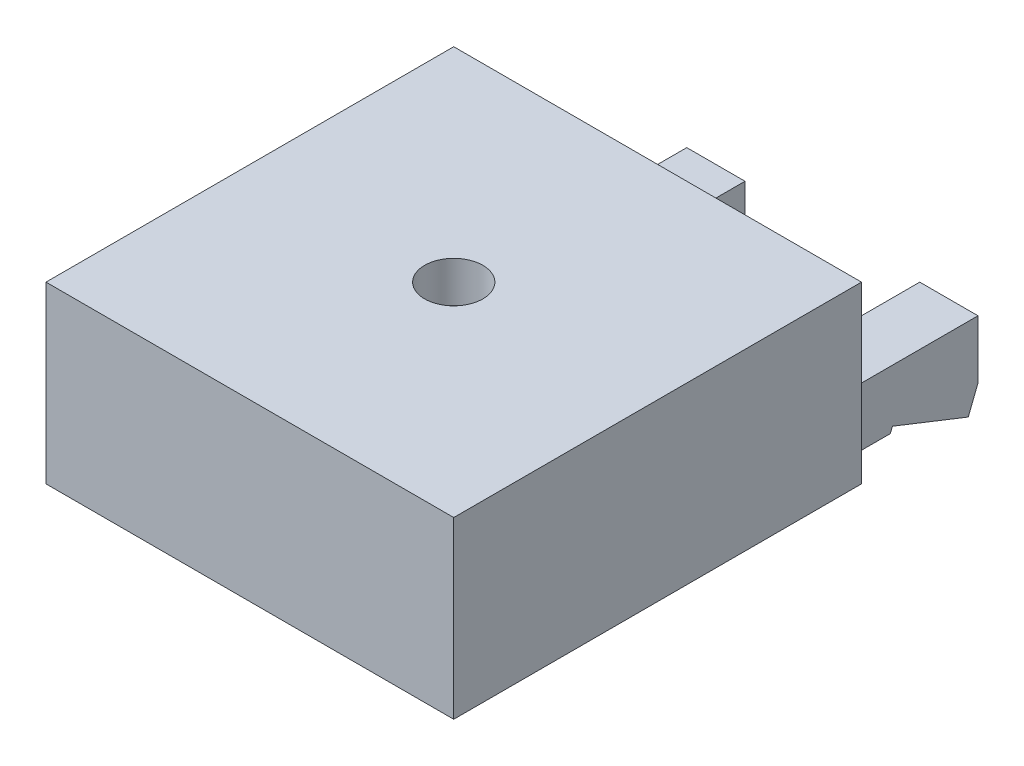
from build123d import *

# Parameters (mm, degrees)
ESQUISSE1_W              = 70
ESQUISSE1_H              = 70
BOSS_EXTRU_4_DEPTH       = 30
ESQUISSE5_W              = 60
ESQUISSE5_H              = 60
ENL_V_MAT_EXTRU_3_DEPTH  = 23
ESQUISSE6_R              = 5
ENL_V_MAT_EXTRU_4_DEPTH  = 23
ESQUISSE28_W             = 10
ESQUISSE28_H             = 30
BOSS_EXTRU_8_DEPTH       = 5
BOSS_EXTRU_9_DEPTH       = 10
ESQUISSE30_W             = 10
ESQUISSE30_H             = 30
BOSS_EXTRU_10_DEPTH      = 5
BOSS_EXTRU_14_DEPTH      = 10
ENL_V_MAT_EXTRU_6_DEPTH  = 10
ENL_V_MAT_EXTRU_15_DEPTH = 14


with BuildPart() as part:
    # Esquisse1 → Boss.-Extru.4 (new body)
    with BuildSketch(Plane(origin=(0, 0, 0), x_dir=(1, 0, 0), z_dir=(0, 1, 0))):
        with Locations((35, 35)):
            Rectangle(ESQUISSE1_W, ESQUISSE1_H)
    extrude(amount=BOSS_EXTRU_4_DEPTH)

    # Esquisse5 → Enlèv. mat.-Extru.3 (cut)
    with BuildSketch(Plane(origin=(0, 0, 0), x_dir=(-1, 0, 0), z_dir=(0, -1, 0))):
        with Locations((-35, 35)):
            Rectangle(ESQUISSE5_W, ESQUISSE5_H)
    extrude(amount=-ENL_V_MAT_EXTRU_3_DEPTH, mode=Mode.SUBTRACT)

    # Esquisse6 → Enlèv. mat.-Extru.4 (cut)
    with BuildSketch(Plane(origin=(0, 23, 0), x_dir=(-1, 0, 0), z_dir=(0, -1, 0))):
        with Locations(Location((-35, 35, 0), (0, 0, 90))):
            Circle(ESQUISSE6_R)
    extrude(amount=-ENL_V_MAT_EXTRU_4_DEPTH, mode=Mode.SUBTRACT)

    # Esquisse28 → Boss.-Extru.8 (add, symmetric)
    with BuildSketch(Plane.XZ):
        with Locations((55.004966989, -85)):
            Rectangle(ESQUISSE28_W, ESQUISSE28_H)
    extrude(amount=BOSS_EXTRU_8_DEPTH, both=True)

    # Esquisse29 → Boss.-Extru.9 (add)
    with BuildSketch(Plane(origin=(60.004966989, 0, 0), x_dir=(0, 0, -1), z_dir=(1, 0, 0))):
        Polygon((98.641624501, -8.437704854), (100, -5), (85, -5), (97.962436751, -10.156557281), align=None)
    extrude(amount=-BOSS_EXTRU_9_DEPTH)

    # Esquisse30 → Boss.-Extru.10 (add, symmetric)
    with BuildSketch(Plane.XZ):
        with Locations((15.004966989, -85)):
            Rectangle(ESQUISSE30_W, ESQUISSE30_H)
    extrude(amount=BOSS_EXTRU_10_DEPTH, both=True)

    # Esquisse39 → Boss.-Extru.14 (add)
    with BuildSketch(Plane.ZY.offset(-10.004966989)):
        Polygon((-100, -5), (-95.960946885, -15.231620103), (-85, -5), align=None)
    extrude(amount=-BOSS_EXTRU_14_DEPTH)

    # Esquisse40 → Enlèv. mat.-Extru.6 (cut)
    with BuildSketch(Plane(origin=(0, -34.827896321, -88.22508495), x_dir=(-1, 0, 0), z_dir=(0, -0.3671866467775486, -0.930147282116257))):
        Polygon((-20.004966989, 21.067928267), (-20.004966989, 22.067928267), (-10.004966989, 21.067928267), align=None)
    extrude(amount=-ENL_V_MAT_EXTRU_6_DEPTH, mode=Mode.SUBTRACT)

    # Esquisse41 → Enlèv. mat.-Extru.15 (cut)
    with BuildSketch(Plane(origin=(0, -34.85291455, -88.203912367), x_dir=(-1, 0, 0), z_dir=(0, -0.36749110102927884, -0.9300270375985252))):
        Polygon((-60.004966989, 27.554450861), (-60.004966989, 26.554450861), (-50.004966989, 26.554450861), align=None)
    extrude(amount=-ENL_V_MAT_EXTRU_15_DEPTH, mode=Mode.SUBTRACT)


solid = part.part
